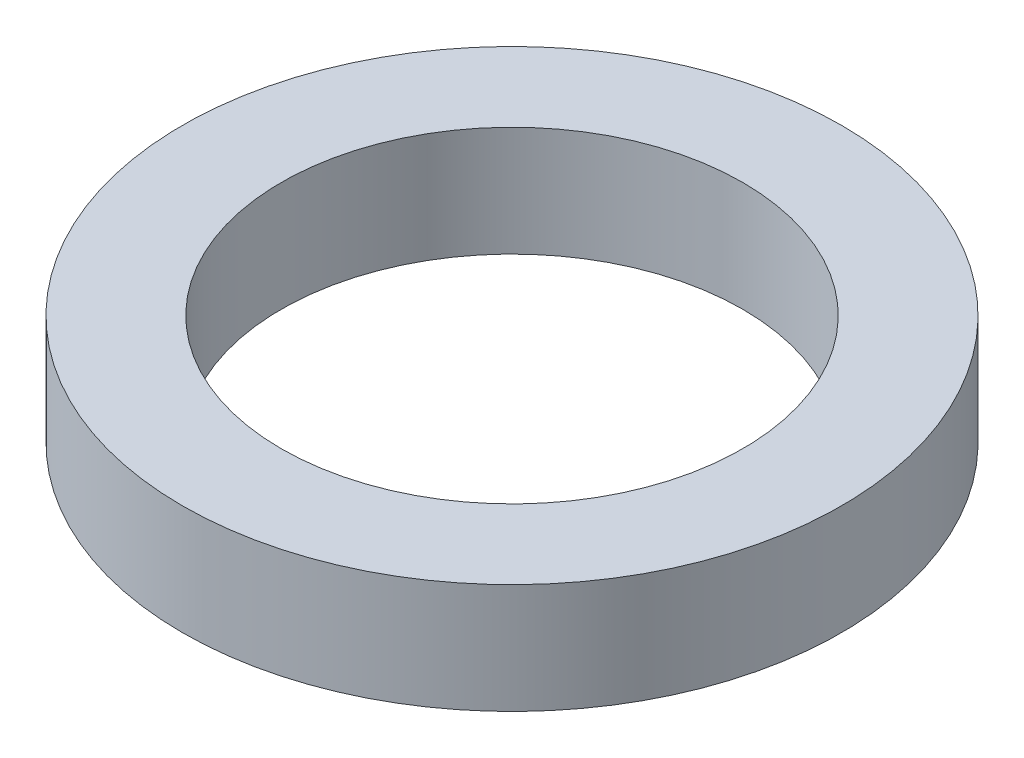
from build123d import *

# Parameters (mm, degrees)
SKETCH_1_R      = 3
SKETCH_1_R_2    = 2.1
EXTRUDE_1_DEPTH = 1


with BuildPart() as part:
    # ｽｹｯﾁ1 → ﾎﾞｽ - 押し出し1 (new body)
    with BuildSketch(Plane(origin=(0, 0, 0), x_dir=(1, 0, 0), z_dir=(0, 1, 0))):
        with Locations(Location((0, 0, 0), (0, 0, 270))):
            Circle(SKETCH_1_R)
        with Locations(Location((0, 0, 0), (0, 0, 270))):
            Circle(SKETCH_1_R_2, mode=Mode.SUBTRACT)
    extrude(amount=EXTRUDE_1_DEPTH)


solid = part.part
